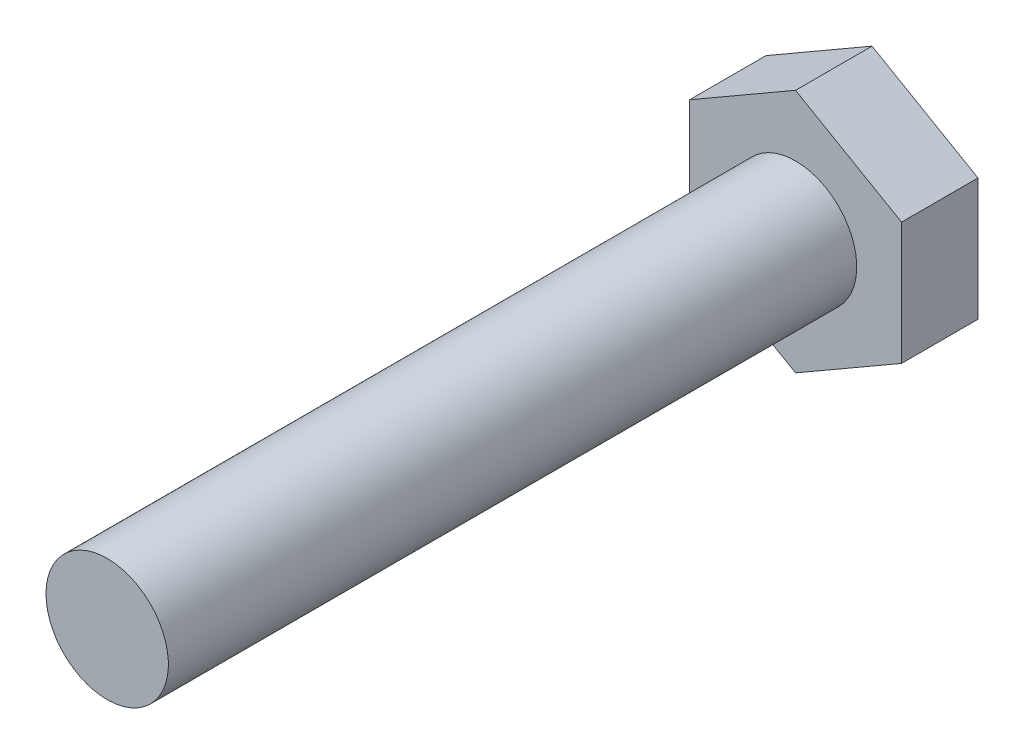
from build123d import *

# Parameters (mm, degrees)
BOSS_EXTRUDE1_DEPTH = 10
SKETCH2_R           = 8
BOSS_EXTRUDE2_DEPTH = 90


with BuildPart() as part:
    # Sketch1 → Boss-Extrude1 (new body)
    with BuildSketch(Plane.XY):
        Polygon((13.856406461, 8), (0, 16), (-13.856406461, 8), (-13.856406461, -8), (0, -16), (13.856406461, -8), align=None)
    extrude(amount=BOSS_EXTRUDE1_DEPTH)

    # Sketch2 → Boss-Extrude2 (add)
    with BuildSketch(Plane.XY.offset(10)):
        with Locations(Location((0, 0, 0), (0, 0, 180))):
            Circle(SKETCH2_R)
    extrude(amount=BOSS_EXTRUDE2_DEPTH)


solid = part.part
